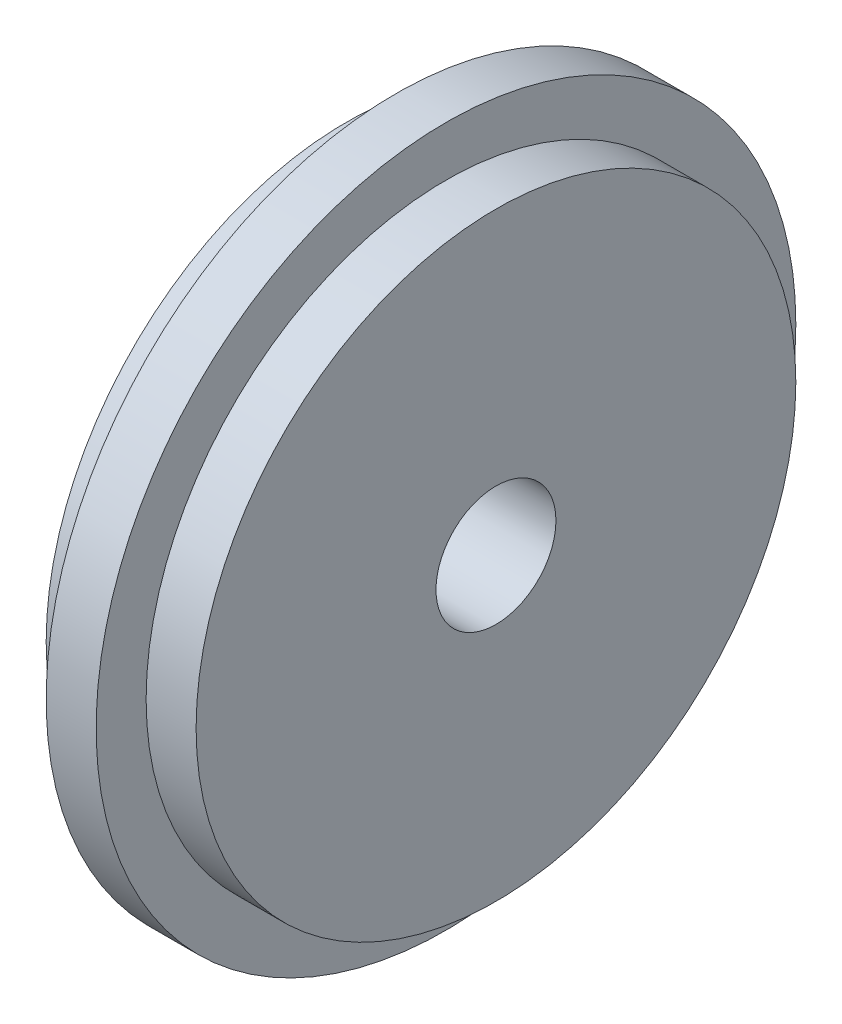
from build123d import *

# Parameters (mm, degrees)
SKETCH1_R                          = 30
CORPO_DA_RODA_DEPTH                = 7.5
SKETCH8_R                          = 35
BOSS_EXTRUDE2_DEPTH                = 2.5
FURO_DO_HUB_MESMO_DI_METRO_1_0_1_D = 12


with BuildPart() as part:
    # Sketch1 → Corpo da Roda (new, symmetric)
    with BuildSketch(Plane(origin=(0, 0, 0), x_dir=(0, 0, -1), z_dir=(1, 0, 0))):
        Circle(SKETCH1_R)
    extrude(amount=CORPO_DA_RODA_DEPTH, both=True)

    # Sketch8 → Boss-Extrude2 (add, symmetric)
    with BuildSketch(Plane(origin=(0, 0, 0), x_dir=(0, 0, -1), z_dir=(1, 0, 0))):
        Circle(SKETCH8_R)
    extrude(amount=BOSS_EXTRUDE2_DEPTH, both=True)

    # Furo do Hub (mesmo diâmetro) - Ø1.0 (1) Diameter Hole1 (through all)
    with Locations(Plane(origin=(7.5, 0, 0), x_dir=(0, 0, -1), z_dir=(1, 0, 0))):
        with Locations((0, 0)):
            Hole(FURO_DO_HUB_MESMO_DI_METRO_1_0_1_D / 2)


solid = part.part
